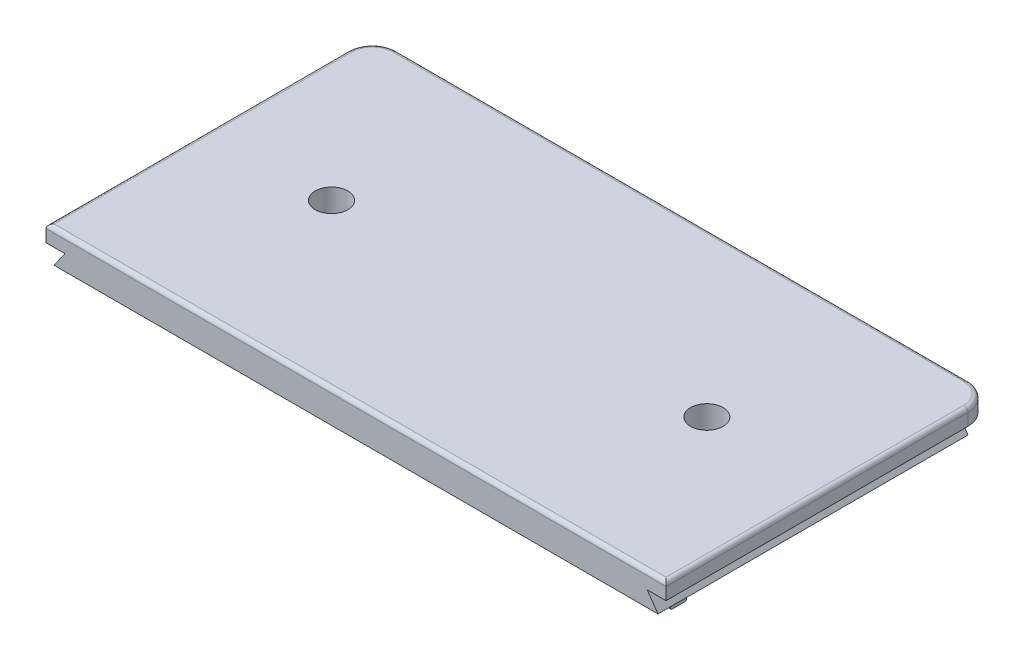
from build123d import *

# Parameters (mm, degrees)
BOSS_EXTRUDE1_DEPTH = 38
SKETCH2_W           = 76
SKETCH2_H           = 2
BOSS_EXTRUDE2_DEPTH = 2
FILLET1_R           = 3
FILLET2_R           = 0.5
CUT_EXTRUDE1_REACH  = 57.31
SKETCH3_R           = 2
SKETCH4_W           = 74.032437302
SKETCH4_H           = 2
BOSS_EXTRUDE3_DEPTH = 0.35
FILLET3_R           = 0.25


with BuildPart() as part:
    # Sketch1 → Boss-Extrude1 (new body)
    with BuildSketch(Plane.XY):
        Polygon((35.755845082, 24), (37.016218651, 22.2), (-37.016218651, 22.2), (-35.755845082, 24), (-35.755845082, 24.1), (-38, 24.1), (-38, 26.1), (38, 26.1), (38, 24.1), (35.755845082, 24.1), align=None)
    extrude(amount=-BOSS_EXTRUDE1_DEPTH)

    # Sketch2 → Boss-Extrude2 (add)
    with BuildSketch(Plane(origin=(0, 0, -38), x_dir=(-1, 0, 0), z_dir=(0, 0, -1))):
        with Locations((0, 25.1)):
            Rectangle(SKETCH2_W, SKETCH2_H)
    extrude(amount=BOSS_EXTRUDE2_DEPTH)

    # Fillet1
    fillet1_edges = [part.edges().sort_by_distance(p)[0] for p in [
        (-38, 25.1, -40),
        (38, 25.1, -40),
    ]]
    fillet(fillet1_edges, radius=FILLET1_R)

    # Fillet2
    fillet2_edges = [part.edges().sort_by_distance(p)[0] for p in [
        (0, 26.1, 0),
        (-38, 26.1, -18.5),
        (0, 26.1, -40),
        (38, 26.1, -18.5),
        (37.121320344, 26.1, -39.121320344),
        (-37.121320344, 26.1, -39.121320344),
    ]]
    fillet(fillet2_edges, radius=FILLET2_R)

    # Sketch3 → Cut-Extrude1 (cut, up to next)
    with BuildSketch(Plane(origin=(0, 26.1, 0), x_dir=(1, 0, 0), z_dir=(0, 1, 0)), mode=Mode.PRIVATE) as cut_extrude1_sk1:
        with Locations(Location((-23, 20, 0), (0, 0, 270))):
            Circle(SKETCH3_R)
    cut_extrude1_tool1 = extrude(cut_extrude1_sk1.sketch, amount=-CUT_EXTRUDE1_REACH, mode=Mode.PRIVATE) & part.part
    # Sketch3 → Cut-Extrude1 (cut, up to next)
    with BuildSketch(Plane(origin=(0, 26.1, 0), x_dir=(1, 0, 0), z_dir=(0, 1, 0)), mode=Mode.PRIVATE) as cut_extrude1_sk2:
        with Locations(Location((23, 20, 0), (0, 0, 180))):
            Circle(SKETCH3_R)
    cut_extrude1_tool2 = extrude(cut_extrude1_sk2.sketch, amount=-CUT_EXTRUDE1_REACH, mode=Mode.PRIVATE) & part.part
    add(cut_extrude1_tool1.solids().sort_by_distance((-23, 26.1, -20))[0], mode=Mode.SUBTRACT)
    add(cut_extrude1_tool2.solids().sort_by_distance((23, 26.1, -20))[0], mode=Mode.SUBTRACT)

    # Sketch4 → Boss-Extrude3 (add)
    with BuildSketch(Plane.XZ.offset(-22.2)):
        with Locations((0, -2.5)):
            Rectangle(SKETCH4_W, SKETCH4_H)
    extrude(amount=BOSS_EXTRUDE3_DEPTH)

    # Fillet3
    fillet3_edges = [part.edges().sort_by_distance(p)[0] for p in [
        (0, 21.85, -1.5),
        (0, 21.85, -3.5),
    ]]
    fillet(fillet3_edges, radius=FILLET3_R)


solid = part.part
